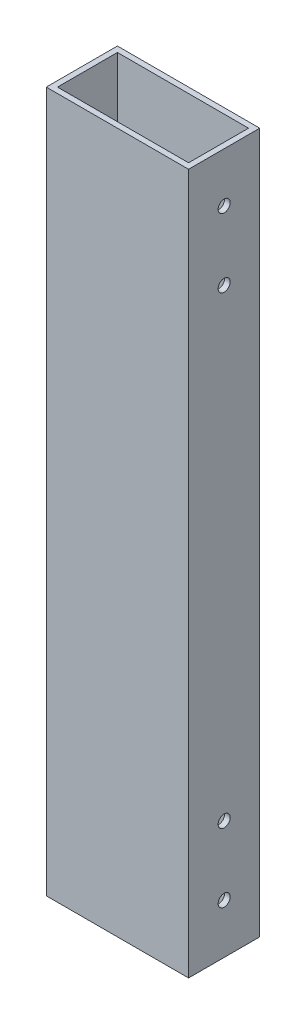
from build123d import *

# Parameters (mm, degrees)
SKETCH_5_W          = 50.8
SKETCH_5_H          = 25.4
EXTRUDE_3_DEPTH     = 250
SKETCH_5_7_W        = 46.8
SKETCH_5_7_H        = 21.4
CUT_EXTRUDE_3_DEPTH = 252.607730406
SKETCH_6_R          = 2.150000004
SKETCH_6_R_2        = 2.15
CUT_EXTRUDE_4_DEPTH = 50.8


with BuildPart() as part:
    # 草圖5 → 填料-伸長3 (new body)
    with BuildSketch(Plane(origin=(0, 0, 0), x_dir=(1, 0, 0), z_dir=(0, 1, 0))):
        Rectangle(SKETCH_5_W, SKETCH_5_H)
    extrude(amount=EXTRUDE_3_DEPTH)

    # 草圖5<7> → 除料-伸長3 (cut, through all)
    with BuildSketch(Plane(origin=(0, 0, 0), x_dir=(1, 0, 0), z_dir=(0, 1, 0))):
        Rectangle(SKETCH_5_7_W, SKETCH_5_7_H)
    extrude(amount=CUT_EXTRUDE_3_DEPTH, mode=Mode.SUBTRACT)

    # 草圖6 → 除料-伸長4 (cut)
    with BuildSketch(Plane.ZY.offset(25.4)):
        with Locations((0, 232.300000014)):
            Circle(SKETCH_6_R)
        with Locations((0, 207.800000014)):
            Circle(SKETCH_6_R)
        with Locations((0, 42.2)):
            Circle(SKETCH_6_R_2)
        with Locations((0, 17.7)):
            Circle(SKETCH_6_R_2)
    extrude(amount=-CUT_EXTRUDE_4_DEPTH, mode=Mode.SUBTRACT)


solid = part.part
